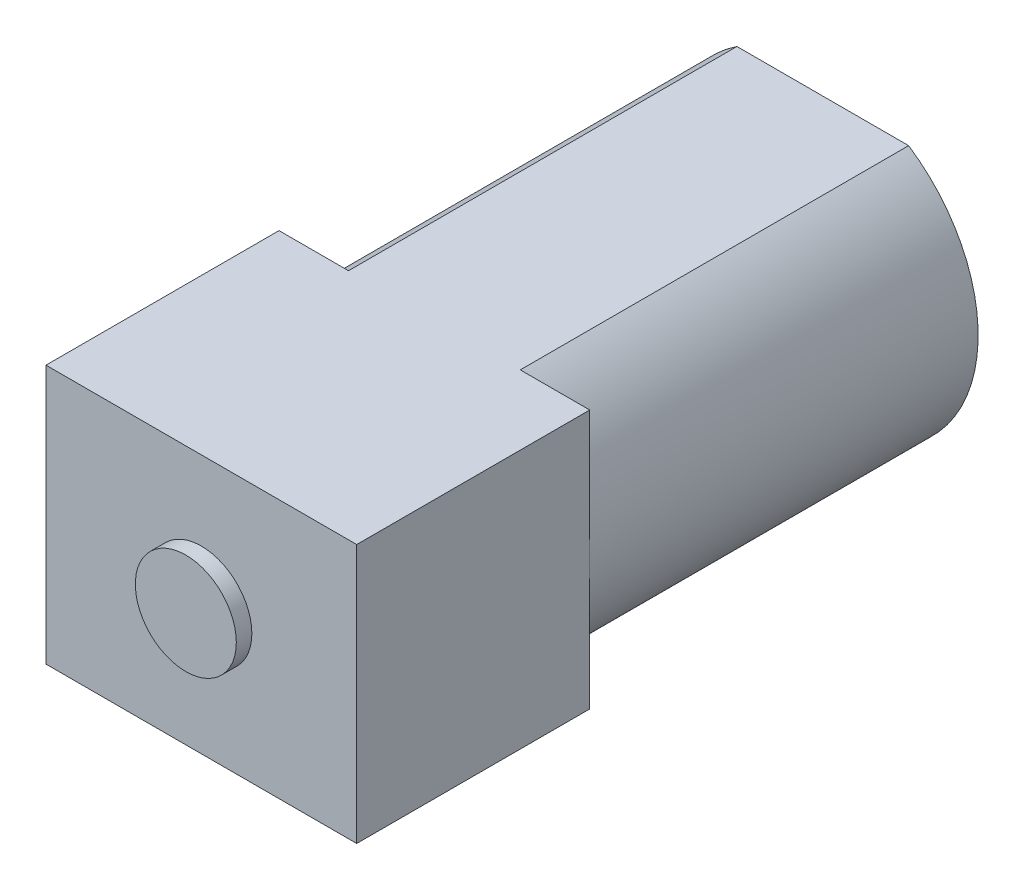
from build123d import *

# Parameters (mm, degrees)
BOSS_EXTRUDE1_DEPTH      = 9
BOSS_EXTRUDE1_DEPTH_BACK = 15
SKETCH1_W                = 12
SKETCH1_H                = 10
SKETCH3_R                = 8.54
SKETCH3_R_2              = 6
CUT_EXTRUDE_THIN1_DEPTH  = 15
SKETCH5_R                = 2.5
BOSS_EXTRUDE2_DEPTH      = 1
SKETCH6_R                = 1.95
BOSS_EXTRUDE3_DEPTH      = 0.6


with BuildPart() as part:
    # Sketch1 → Boss-Extrude1 (new, two sides: drawn at the far end of the back side and taken through both)
    with BuildSketch(Plane.XY.offset(-BOSS_EXTRUDE1_DEPTH_BACK)):
        Rectangle(SKETCH1_W, SKETCH1_H)
    extrude(amount=BOSS_EXTRUDE1_DEPTH + BOSS_EXTRUDE1_DEPTH_BACK)

    # Sketch3 → Cut-Extrude-Thin1 (cut)
    with BuildSketch(Plane(origin=(0, 0, -15), x_dir=(-1, 0, 0), z_dir=(0, 0, -1))):
        Circle(SKETCH3_R)
        Circle(SKETCH3_R_2, mode=Mode.SUBTRACT)
    extrude(amount=-CUT_EXTRUDE_THIN1_DEPTH, mode=Mode.SUBTRACT)

    # Sketch5 → Boss-Extrude2 (add)
    with BuildSketch(Plane(origin=(0, 0, -15), x_dir=(-1, 0, 0), z_dir=(0, 0, -1))):
        with Locations(Location((0, 0, 0), (0, 0, 180))):
            Circle(SKETCH5_R)
    extrude(amount=BOSS_EXTRUDE2_DEPTH)

    # Sketch6 → Boss-Extrude3 (add)
    with BuildSketch(Plane.XY.offset(9)):
        Circle(SKETCH6_R)
    extrude(amount=BOSS_EXTRUDE3_DEPTH)


solid = part.part
